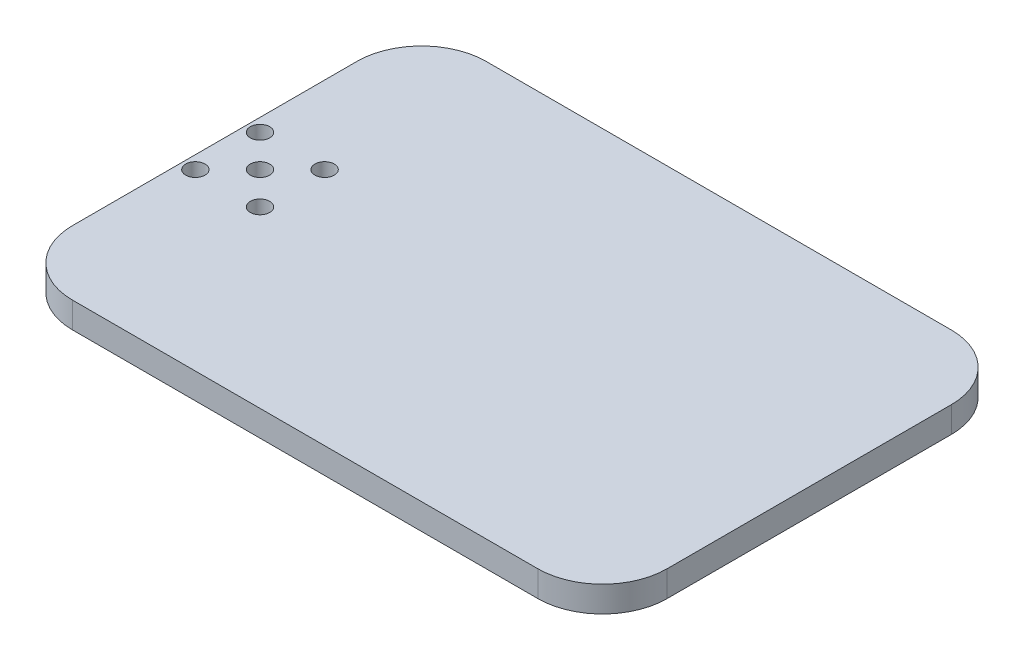
from build123d import *

# Parameters (mm, degrees)
BOSS_EXTRUDE1_DEPTH = 2
CUT_EXTRUDE2_REACH  = 58.071
SKETCH8_R           = 0.75


with BuildPart() as part:
    # Sketch1 → Boss-Extrude1 (new body)
    with BuildSketch(Plane(origin=(0, 0, 0), x_dir=(1, 0, 0), z_dir=(0, 1, 0))):
        with BuildLine():
            Line((5, 0), (41, 0))
            ThreePointArc((41, 0), (44.535533906, 1.464466094), (46, 5))
            Line((46, 5), (46, 27))
            ThreePointArc((46, 27), (44.535533906, 30.535533906), (41, 32))
            Line((41, 32), (5, 32))
            ThreePointArc((5, 32), (1.464466094, 30.535533906), (0, 27))
            Line((0, 27), (0, 5))
            ThreePointArc((0, 5), (1.464466094, 1.464466094), (5, 0))
        make_face()
    extrude(amount=BOSS_EXTRUDE1_DEPTH)

    # Sketch8 → Cut-Extrude2 (cut, up to next)
    with BuildSketch(Plane(origin=(0, 2, 0), x_dir=(1, 0, 0), z_dir=(0, 1, 0)), mode=Mode.PRIVATE) as cut_extrude2_sk1:
        with Locations(Location((3.5, 16, 0), (0, 0, 270))):
            Circle(SKETCH8_R)
    cut_extrude2_tool1 = extrude(cut_extrude2_sk1.sketch, amount=-CUT_EXTRUDE2_REACH, mode=Mode.PRIVATE) & part.part
    # Sketch8 → Cut-Extrude2 (cut, up to next)
    with BuildSketch(Plane(origin=(0, 2, 0), x_dir=(1, 0, 0), z_dir=(0, 1, 0)), mode=Mode.PRIVATE) as cut_extrude2_sk2:
        with Locations(Location((6, 18.5, 0), (0, 0, 270))):
            Circle(SKETCH8_R)
    cut_extrude2_tool2 = extrude(cut_extrude2_sk2.sketch, amount=-CUT_EXTRUDE2_REACH, mode=Mode.PRIVATE) & part.part
    # Sketch8 → Cut-Extrude2 (cut, up to next)
    with BuildSketch(Plane(origin=(0, 2, 0), x_dir=(1, 0, 0), z_dir=(0, 1, 0)), mode=Mode.PRIVATE) as cut_extrude2_sk3:
        with Locations(Location((6, 13.5, 0), (0, 0, 270))):
            Circle(SKETCH8_R)
    cut_extrude2_tool3 = extrude(cut_extrude2_sk3.sketch, amount=-CUT_EXTRUDE2_REACH, mode=Mode.PRIVATE) & part.part
    # Sketch8 → Cut-Extrude2 (cut, up to next)
    with BuildSketch(Plane(origin=(0, 2, 0), x_dir=(1, 0, 0), z_dir=(0, 1, 0)), mode=Mode.PRIVATE) as cut_extrude2_sk4:
        with Locations(Location((1, 13.499992953, 0), (0, 0, 270))):
            Circle(SKETCH8_R)
    cut_extrude2_tool4 = extrude(cut_extrude2_sk4.sketch, amount=-CUT_EXTRUDE2_REACH, mode=Mode.PRIVATE) & part.part
    # Sketch8 → Cut-Extrude2 (cut, up to next)
    with BuildSketch(Plane(origin=(0, 2, 0), x_dir=(1, 0, 0), z_dir=(0, 1, 0)), mode=Mode.PRIVATE) as cut_extrude2_sk5:
        with Locations(Location((1, 18.499992953, 0), (0, 0, 270))):
            Circle(SKETCH8_R)
    cut_extrude2_tool5 = extrude(cut_extrude2_sk5.sketch, amount=-CUT_EXTRUDE2_REACH, mode=Mode.PRIVATE) & part.part
    add(cut_extrude2_tool1.solids().sort_by_distance((3.5, 2, -16))[0], mode=Mode.SUBTRACT)
    add(cut_extrude2_tool2.solids().sort_by_distance((6, 2, -18.5))[0], mode=Mode.SUBTRACT)
    add(cut_extrude2_tool3.solids().sort_by_distance((6, 2, -13.5))[0], mode=Mode.SUBTRACT)
    add(cut_extrude2_tool4.solids().sort_by_distance((1, 2, -13.499993))[0], mode=Mode.SUBTRACT)
    add(cut_extrude2_tool5.solids().sort_by_distance((1, 2, -18.499993))[0], mode=Mode.SUBTRACT)


solid = part.part
